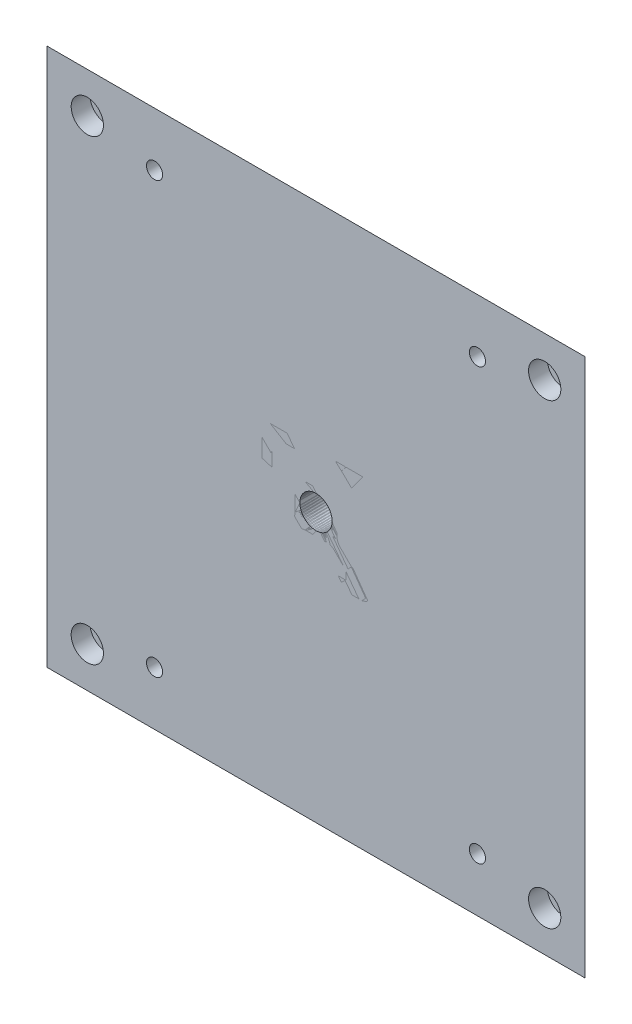
from build123d import *

# Parameters (mm, degrees)
SKETCH1_R                = 3
EXTRUDE_1_DEPTH          = 175
SKETCH_1_W               = 100
SKETCH_1_H               = 100
EXTRUDE_2_DEPTH          = 40
EXTRUDE_2_DRAFT          = -45
SKETCH_3_R               = 1.5
CUT_EXTRUDE_2_DEPTH      = 40
SKETCH_4_W               = 8
SKETCH_4_H               = 8
CUT_REVOLVE_1_ANGLE      = 45
CUT_EXTRUDE_4_DEPTH      = 189.745860882
CUT_EXTRUDE_4_DEPTH_BACK = 175
SKETCH_6_R               = 3
SKETCH_8_R               = 3
CUT_EXTRUDE_6_DEPTH      = 3.5
SKETCH_9_W               = 20.3
SKETCH_9_H               = 20.3
CUT_EXTRUDE_7_DEPTH      = 169
SKETCH_10_W              = 8
SKETCH_10_H              = 8
CUT_REVOLVE_3_ANGLE      = 45


with BuildPart() as part:
    # Sketch1 → Бобышка-Вытянуть1 (new body)
    with BuildSketch(Plane.XY):
        with BuildLine():
            Line((0, 3.9), (-2.010912703, 3.9))
            ThreePointArc((-2.010912703, 3.9), (-2.776279568, 4.052240935), (-3.425126266, 4.485786438))
            Line((-3.425126266, 4.485786438), (-5.539339828, 6.6))
            Line((-5.539339828, 6.6), (-5.539339828, 8.2))
            Line((-5.539339828, 8.2), (-3.1, 8.2))
            Line((-3.1, 8.2), (-3.1, 9.5))
            Line((-3.1, 9.5), (-3.4, 9.5))
            ThreePointArc((-3.4, 9.5), (-3.541421356, 9.558578644), (-3.6, 9.7))
            Line((-3.6, 9.7), (-3.6, 10))
            Line((-3.6, 10), (-8.5, 10))
            ThreePointArc((-8.5, 10), (-9.560660172, 9.560660172), (-10, 8.5))
            Line((-10, 8.5), (-10, 3.6))
            Line((-10, 3.6), (-9.7, 3.6))
            ThreePointArc((-9.7, 3.6), (-9.558578644, 3.541421356), (-9.5, 3.4))
            Line((-9.5, 3.4), (-9.5, 3.1))
            Line((-9.5, 3.1), (-8.2, 3.1))
            Line((-8.2, 3.1), (-8.2, 5.539339828))
            Line((-8.2, 5.539339828), (-6.6, 5.539339828))
            Line((-6.6, 5.539339828), (-4.485786438, 3.425126266))
            ThreePointArc((-4.485786438, 3.425126266), (-4.052240935, 2.776279568), (-3.9, 2.010912703))
            Line((-3.9, 2.010912703), (-3.9, 0))
            Line((-3.9, 0), (-3.9, -2.010912703))
            ThreePointArc((-3.9, -2.010912703), (-4.052240935, -2.776279568), (-4.485786438, -3.425126266))
            Line((-4.485786438, -3.425126266), (-6.6, -5.539339828))
            Line((-6.6, -5.539339828), (-8.2, -5.539339828))
            Line((-8.2, -5.539339828), (-8.2, -3.1))
            Line((-8.2, -3.1), (-9.5, -3.1))
            Line((-9.5, -3.1), (-9.5, -3.4))
            ThreePointArc((-9.5, -3.4), (-9.558578644, -3.541421356), (-9.7, -3.6))
            Line((-9.7, -3.6), (-10, -3.6))
            Line((-10, -3.6), (-10, -8.5))
            ThreePointArc((-10, -8.5), (-9.560660172, -9.560660172), (-8.5, -10))
            Line((-8.5, -10), (-3.6, -10))
            Line((-3.6, -10), (-3.6, -9.7))
            ThreePointArc((-3.6, -9.7), (-3.541421356, -9.558578644), (-3.4, -9.5))
            Line((-3.4, -9.5), (-3.1, -9.5))
            Line((-3.1, -9.5), (-3.1, -8.2))
            Line((-3.1, -8.2), (-5.539339828, -8.2))
            Line((-5.539339828, -8.2), (-5.539339828, -6.6))
            Line((-5.539339828, -6.6), (-3.425126266, -4.485786438))
            ThreePointArc((-3.425126266, -4.485786438), (-2.776279568, -4.052240935), (-2.010912703, -3.9))
            Line((-2.010912703, -3.9), (0, -3.9))
            Line((0, -3.9), (2.010912703, -3.9))
            ThreePointArc((2.010912703, -3.9), (2.776279568, -4.052240935), (3.425126266, -4.485786438))
            Line((3.425126266, -4.485786438), (5.539339828, -6.6))
            Line((5.539339828, -6.6), (5.539339828, -8.2))
            Line((5.539339828, -8.2), (3.1, -8.2))
            Line((3.1, -8.2), (3.1, -9.5))
            Line((3.1, -9.5), (3.4, -9.5))
            ThreePointArc((3.4, -9.5), (3.541421356, -9.558578644), (3.6, -9.7))
            Line((3.6, -9.7), (3.6, -10))
            Line((3.6, -10), (8.5, -10))
            ThreePointArc((8.5, -10), (9.560660172, -9.560660172), (10, -8.5))
            Line((10, -8.5), (10, -3.6))
            Line((10, -3.6), (9.7, -3.6))
            ThreePointArc((9.7, -3.6), (9.558578644, -3.541421356), (9.5, -3.4))
            Line((9.5, -3.4), (9.5, -3.1))
            Line((9.5, -3.1), (8.2, -3.1))
            Line((8.2, -3.1), (8.2, -5.539339828))
            Line((8.2, -5.539339828), (6.6, -5.539339828))
            Line((6.6, -5.539339828), (4.485786438, -3.425126266))
            ThreePointArc((4.485786438, -3.425126266), (4.052240935, -2.776279568), (3.9, -2.010912703))
            Line((3.9, -2.010912703), (3.9, 0))
            Line((3.9, 0), (3.9, 2.010912703))
            ThreePointArc((3.9, 2.010912703), (4.052240935, 2.776279568), (4.485786438, 3.425126266))
            Line((4.485786438, 3.425126266), (6.6, 5.539339828))
            Line((6.6, 5.539339828), (8.2, 5.539339828))
            Line((8.2, 5.539339828), (8.2, 3.1))
            Line((8.2, 3.1), (9.5, 3.1))
            Line((9.5, 3.1), (9.5, 3.4))
            ThreePointArc((9.5, 3.4), (9.558578644, 3.541421356), (9.7, 3.6))
            Line((9.7, 3.6), (10, 3.6))
            Line((10, 3.6), (10, 8.5))
            ThreePointArc((10, 8.5), (9.560660172, 9.560660172), (8.5, 10))
            Line((8.5, 10), (3.6, 10))
            Line((3.6, 10), (3.6, 9.7))
            ThreePointArc((3.6, 9.7), (3.541421356, 9.558578644), (3.4, 9.5))
            Line((3.4, 9.5), (3.1, 9.5))
            Line((3.1, 9.5), (3.1, 8.2))
            Line((3.1, 8.2), (5.539339828, 8.2))
            Line((5.539339828, 8.2), (5.539339828, 6.6))
            Line((5.539339828, 6.6), (3.425126266, 4.485786438))
            ThreePointArc((3.425126266, 4.485786438), (2.776279568, 4.052240935), (2.010912703, 3.9))
            Line((2.010912703, 3.9), (0, 3.9))
        make_face()
        Circle(SKETCH1_R, mode=Mode.SUBTRACT)
    extrude(amount=EXTRUDE_1_DEPTH)


with BuildPart() as body_2:
    # Эскиз1 → Бобышка-Вытянуть2 (with draft: the straight prism first)
    with BuildSketch(Plane.XY.offset(175)):
        Rectangle(SKETCH_1_W, SKETCH_1_H)
    extrude(amount=-EXTRUDE_2_DEPTH)
    # Бобышка-Вытянуть2: the draft: its side faces are tilted about the plane it starts from
    extrude_2_sides = [body_2.faces().sort_by_distance(p)[0] for p in [
        (0, -50, 155),
        (50, 0, 155),
        (0, 50, 155),
        (-50, 0, 155),
    ]]
    draft(extrude_2_sides, Plane.XY.offset(175), EXTRUDE_2_DRAFT)

    # Эскиз3 → Вырез-Вытянуть2 (cut)
    with BuildSketch(Plane.XY.offset(175)):
        with Locations((-30, 40)):
            Circle(SKETCH_3_R)
        with Locations(Location((30, 40, 0), (0, 0, 90))):
            Circle(SKETCH_3_R)
        with Locations((30, -40)):
            Circle(SKETCH_3_R)
        with Locations(Location((-30, -40, 0), (0, 0, 270))):
            Circle(SKETCH_3_R)
    extrude(amount=-CUT_EXTRUDE_2_DEPTH, mode=Mode.SUBTRACT)

    # Эскиз4 → Вырез-Повернуть1 (revolve, cut)
    with BuildSketch(Plane(origin=(0, 62.5, 62.5), x_dir=(1, 0, 0), z_dir=(0, -0.7071067811865462, -0.7071067811865488))):
        with Locations((-30, 144.956890143)):
            Rectangle(SKETCH_4_W, SKETCH_4_H)
        with Locations((30, 144.956890143)):
            Rectangle(SKETCH_4_W, SKETCH_4_H)
    revolve(axis=Axis((-34, -42.828427125, 167.828427125), (1, 0, 0)), revolution_arc=CUT_REVOLVE_1_ANGLE, mode=Mode.SUBTRACT)

    # Эскиз6 → Вырез-Вытянуть4 (cut, two sides: drawn at the far end of the back side and taken through both)
    with BuildSketch(Plane(origin=(0, 0, 0), x_dir=(-1, 0, 0), z_dir=(0, 0, -1)).offset(-CUT_EXTRUDE_4_DEPTH_BACK)):
        Circle(SKETCH_6_R)
    extrude(amount=CUT_EXTRUDE_4_DEPTH + CUT_EXTRUDE_4_DEPTH_BACK, mode=Mode.SUBTRACT)

    # Эскиз8 → Вырез-Вытянуть6 (cut)
    with BuildSketch(Plane.XY.offset(175)):
        with Locations((-42.5, 42.5)):
            Circle(SKETCH_8_R)
        with Locations(Location((42.5, 42.5, 0), (0, 0, 180))):
            Circle(SKETCH_8_R)
        with Locations((42.5, -42.5)):
            Circle(SKETCH_8_R)
        with Locations(Location((-42.5, -42.5, 0), (0, 0, 180))):
            Circle(SKETCH_8_R)
    extrude(amount=-CUT_EXTRUDE_6_DEPTH, mode=Mode.SUBTRACT)


with BuildPart() as cut_extrude_7_tool:
    # Эскиз9 → Вырез-Вытянуть7 (new body)
    with BuildSketch(Plane(origin=(0, 0, 0), x_dir=(-1, 0, 0), z_dir=(0, 0, -1))):
        Rectangle(SKETCH_9_W, SKETCH_9_H)
    extrude(amount=-CUT_EXTRUDE_7_DEPTH)


with BuildPart() as part_1:
    add(part.part)

    # Вырез-Вытянуть7: cut by cut_extrude_7_tool
    add(cut_extrude_7_tool.part, mode=Mode.SUBTRACT)


with BuildPart() as body_2_1:
    add(body_2.part)

    # Вырез-Вытянуть7: cut by cut_extrude_7_tool
    add(cut_extrude_7_tool.part, mode=Mode.SUBTRACT)

    # Эскиз10 → Вырез-Повернуть3 (revolve, cut)
    with BuildSketch(Plane(origin=(0, -62.5, 62.5), x_dir=(1, 0, 0), z_dir=(0, 0.7071067811865462, -0.7071067811865488))):
        with Locations((-30, -144.956890143)):
            Rectangle(SKETCH_10_W, SKETCH_10_H)
        with Locations((30, -144.956890143)):
            Rectangle(SKETCH_10_W, SKETCH_10_H)
    revolve(axis=Axis((34, 42.828427125, 167.828427125), (-1, 0, 0)), revolution_arc=CUT_REVOLVE_3_ANGLE, mode=Mode.SUBTRACT)


solid = Compound([part_1.part, body_2_1.part])
